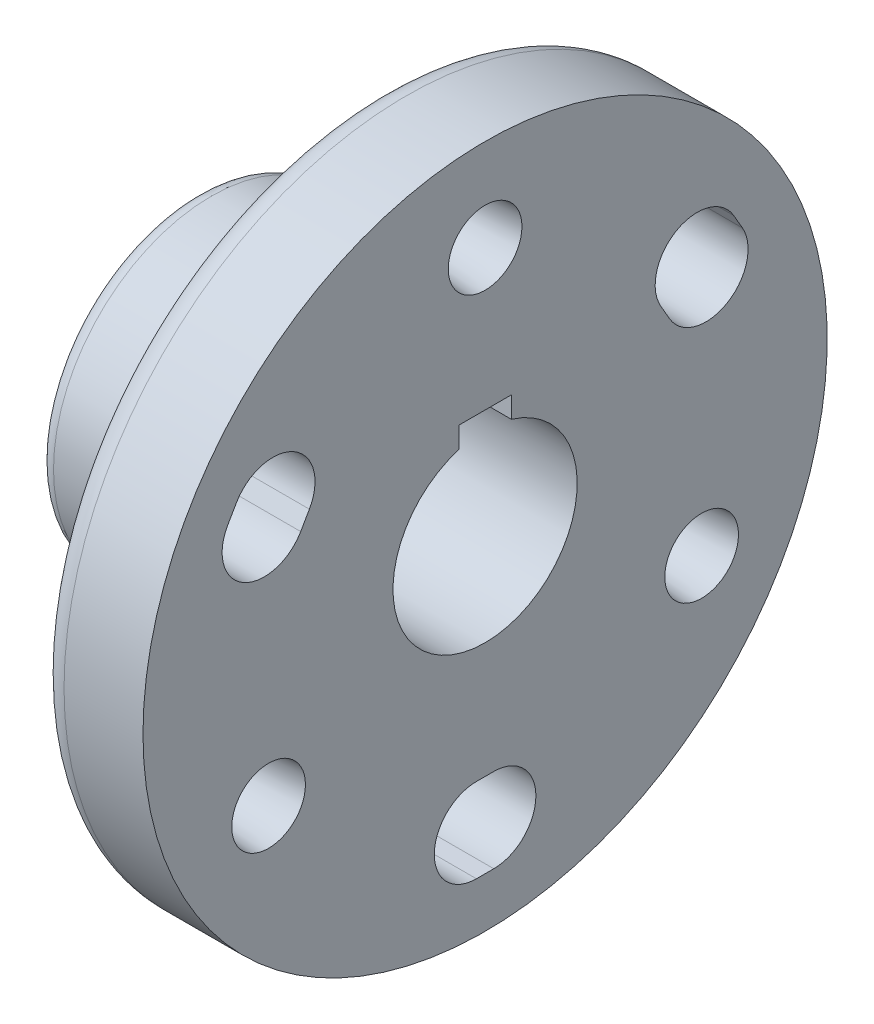
from build123d import *

# Parameters (mm, degrees)
SKETCH2_R          = 17.5
CUT_EXTRUDE1_DEPTH = 108.12142655
SKETCH3_W          = 10
SKETCH3_H          = 6.6
CUT_EXTRUDE2_DEPTH = 108.12142655
SKETCH4_R          = 4
CUT_EXTRUDE3_DEPTH = 10
CUT_EXTRUDE4_DEPTH = 108.12142655


with BuildPart() as part:
    # Sketch1 → Revolve1 (revolve)
    with BuildSketch(Plane.XY):
        with BuildLine():
            Line((-55, 0), (0, 0))
            Line((0, 0), (0, 65))
            Line((0, 65), (-15, 65))
            ThreePointArc((-15, 65), (-18.535533906, 63.535533906), (-20, 60))
            Line((-20, 60), (-20, 38))
            ThreePointArc((-20, 38), (-22.343145751, 32.343145751), (-28, 30))
            Line((-28, 30), (-52, 30))
            ThreePointArc((-52, 30), (-54.121320344, 29.121320344), (-55, 27))
            Line((-55, 27), (-55, 0))
        make_face()
    revolve(axis=Axis((-55, 0, 0), (1, 0, 0)))

    # Sketch2 → Cut-Extrude1 (cut, through all)
    with BuildSketch(Plane.ZY.offset(55)):
        Circle(SKETCH2_R)
    extrude(amount=-CUT_EXTRUDE1_DEPTH, mode=Mode.SUBTRACT)

    # Sketch3 → Cut-Extrude2 (cut, through all)
    with BuildSketch(Plane(origin=(0, 0, 0), x_dir=(0, 0, -1), z_dir=(1, 0, 0))):
        with Locations((0, 17.5)):
            Rectangle(SKETCH3_W, SKETCH3_H)
    extrude(amount=-CUT_EXTRUDE2_DEPTH, mode=Mode.SUBTRACT)

    # Sketch4 → Cut-Extrude3 (cut)
    with BuildSketch(Plane(origin=(0, -30, 0), x_dir=(-1, 0, 0), z_dir=(0, -1, 0))):
        with Locations((40.229772479, 0)):
            Circle(SKETCH4_R)
    extrude(amount=-CUT_EXTRUDE3_DEPTH, mode=Mode.SUBTRACT)

    # Sketch5 → Cut-Extrude4 (cut, through all)
    with BuildSketch(Plane(origin=(0, 0, 0), x_dir=(0, 0, -1), z_dir=(1, 0, 0))):
        with BuildLine():
            Line((1.65, -39.5), (-1.65, -39.5))
            ThreePointArc((-1.65, -39.5), (-9.65, -47.5), (-1.65, -55.5))
            Line((-1.65, -55.5), (1.65, -55.5))
            ThreePointArc((1.65, -55.5), (9.65, -47.5), (1.65, -39.5))
        make_face()
        with BuildLine():
            ThreePointArc((-48.88940991, 26.321058084), (-45.96120668, 15.392854853), (-35.033003449, 18.321058084))
            Line((-35.033003449, 18.321058084), (-33.383003449, 21.178941916))
            ThreePointArc((-33.383003449, 21.178941916), (-36.31120668, 32.107145147), (-47.23940991, 29.178941916))
            Line((-47.23940991, 29.178941916), (-48.88940991, 26.321058084))
        make_face()
        with BuildLine():
            ThreePointArc((35.033003449, 18.321058084), (45.96120668, 15.392854853), (48.88940991, 26.321058084))
            Line((48.88940991, 26.321058084), (47.23940991, 29.178941916))
            ThreePointArc((47.23940991, 29.178941916), (36.31120668, 32.107145147), (33.383003449, 21.178941916))
            Line((33.383003449, 21.178941916), (35.033003449, 18.321058084))
        make_face()
    extrude(amount=-CUT_EXTRUDE4_DEPTH, mode=Mode.SUBTRACT)

    # Cut-Extrude5 cone 1 section (through the dimple's axis) → Cut-Extrude5 (revolve, cut)
    with BuildSketch(Plane(origin=(0, -23.75, 41.13620668), x_dir=(0, 0, -1), z_dir=(0, 1, 0))):
        Polygon((0, 0), (7, 0), (0, 93.336682434), align=None)
    revolve(axis=Axis((0, -23.75, 41.13620668), (-1, 0, 0)), mode=Mode.SUBTRACT)

    # Cut-Extrude5 cone 2 section (through the dimple's axis) → Cut-Extrude5 cone 2 (revolve, cut)
    with BuildSketch(Plane(origin=(0, -23.75, -41.13620668), x_dir=(0, 0, -1), z_dir=(0, 1, 0))):
        Polygon((0, 0), (7, 0), (0, 93.336682434), align=None)
    revolve(axis=Axis((0, -23.75, -41.13620668), (-1, 0, 0)), mode=Mode.SUBTRACT)

    # Cut-Extrude5 cone 3 section (through the dimple's axis) → Cut-Extrude5 cone 3 (revolve, cut)
    with BuildSketch(Plane(origin=(0, 47.5, 0), x_dir=(0, 0, -1), z_dir=(0, 1, 0))):
        Polygon((0, 0), (7, 0), (0, 93.336682434), align=None)
    revolve(axis=Axis((0, 47.5, 0), (-1, 0, 0)), mode=Mode.SUBTRACT)


solid = part.part
